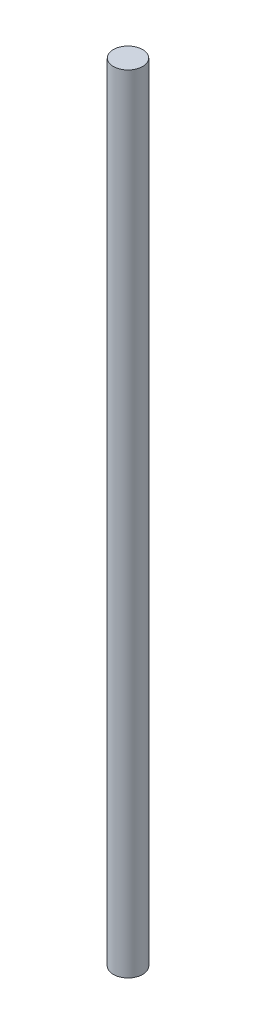
from build123d import *

# Parameters (mm, degrees)
SKETCH1_R           = 0.94869
BOSS_EXTRUDE1_DEPTH = 50.8


with BuildPart() as part:
    # Sketch1 → Boss-Extrude1 (new body)
    with BuildSketch(Plane(origin=(0, 0, 0), x_dir=(1, 0, 0), z_dir=(0, 1, 0))):
        with Locations(Location((0, 0, 0), (0, 0, 270))):
            Circle(SKETCH1_R)
    extrude(amount=BOSS_EXTRUDE1_DEPTH)


solid = part.part
